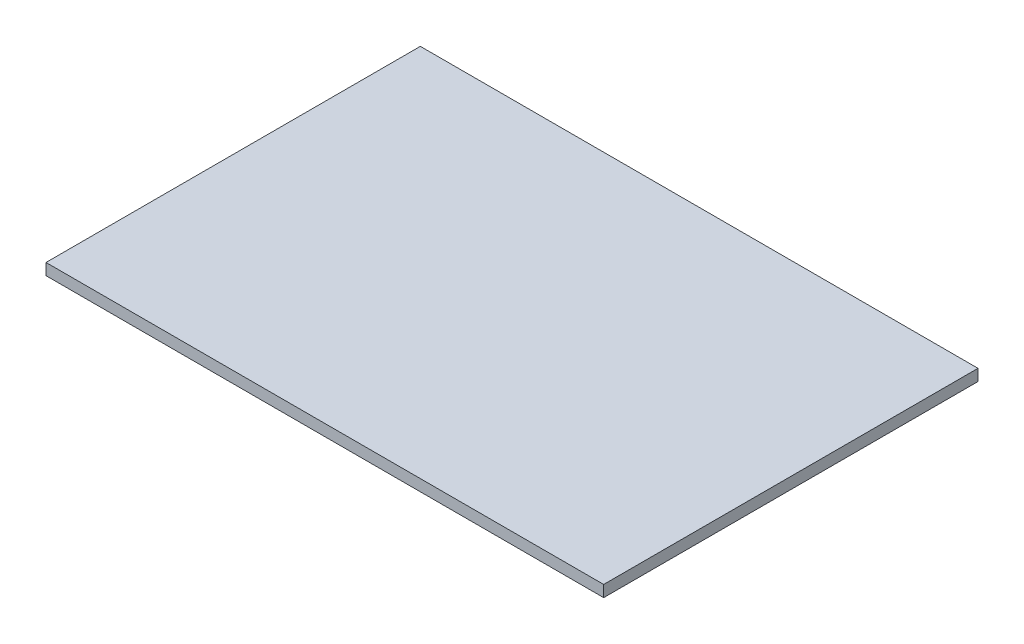
from build123d import *

# Parameters (mm, degrees)
SKETCH1_W           = 927.1
SKETCH1_H           = 622.3
BOSS_EXTRUDE1_DEPTH = 19.05


with BuildPart() as part:
    # Sketch1 → Boss-Extrude1 (new body)
    with BuildSketch(Plane(origin=(0, 0, 0), x_dir=(1, 0, 0), z_dir=(0, 1, 0))):
        with Locations((463.55, 311.15)):
            Rectangle(SKETCH1_W, SKETCH1_H)
    extrude(amount=BOSS_EXTRUDE1_DEPTH)


solid = part.part
